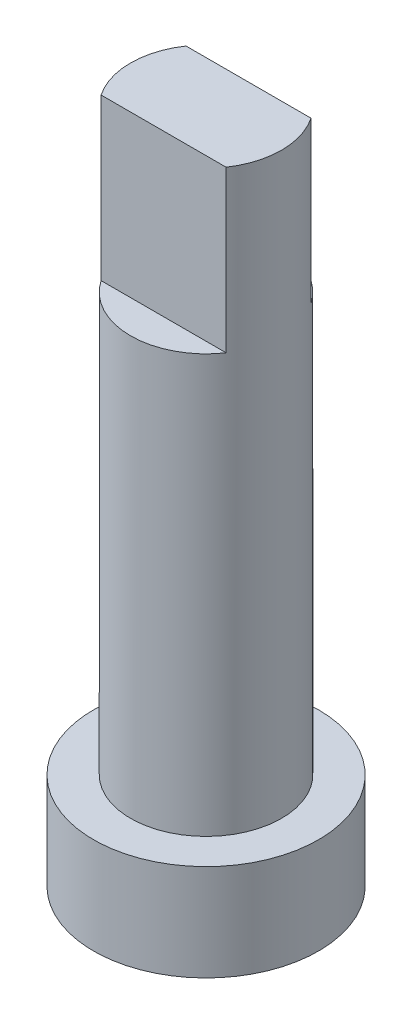
from build123d import *

# Parameters (mm, degrees)
SKETCH_1_R          = 2.35
EXTRUDE_1_DEPTH     = 18
SKETCH_3_R          = 3.5
EXTRUDE_2_DEPTH     = 3
CUT_EXTRUDE_2_DEPTH = 5


with BuildPart() as part:
    # 스케치1 → 보스-돌출1 (new body)
    with BuildSketch(Plane(origin=(0, 0, 0), x_dir=(1, 0, 0), z_dir=(0, 1, 0))):
        with Locations(Location((0, 0, 0), (0, 0, 270))):
            Circle(SKETCH_1_R)
    extrude(amount=EXTRUDE_1_DEPTH)

    # 스케치3 → 보스-돌출2 (add)
    with BuildSketch(Plane(origin=(0, 0, 0), x_dir=(-1, 0, 0), z_dir=(0, -1, 0))):
        with Locations(Location((0, 0, 0), (0, 0, 90))):
            Circle(SKETCH_3_R)
    extrude(amount=EXTRUDE_2_DEPTH)

    # 스케치6 → 컷-돌출2 (cut)
    with BuildSketch(Plane(origin=(0, 18, 0), x_dir=(1, 0, 0), z_dir=(0, 1, 0))):
        Polygon((1.99637355, 1.320619816), (-1.996753764, 1.320619816), (-2.00362645, 2.467115277), (1.99637355, 2.467115277), align=None)
        Polygon((1.99637355, -2.467115277), (1.99637355, -1.320619816), (-1.996753764, -1.320619816), (-2.00362645, -2.467115277), align=None)
    extrude(amount=-CUT_EXTRUDE_2_DEPTH, mode=Mode.SUBTRACT)


solid = part.part
